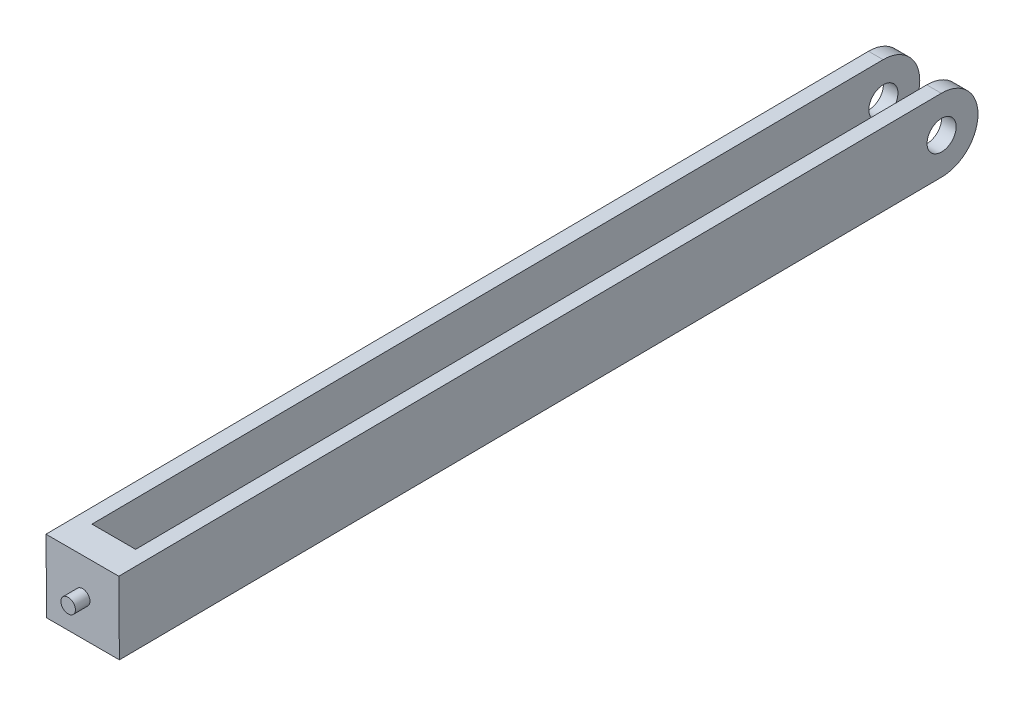
from build123d import *

# Parameters (mm, degrees)
SKETCH1_R               = 5
BOSS_EXTRUDE1_DEPTH     = 25
CUT_EXTRUDE1_DEPTH      = 35
CUT_EXTRUDE1_DEPTH_BACK = 15
SKETCH2_W               = 15
SKETCH2_H               = 290
SKETCH3_R               = 5
CUT_EXTRUDE4_DEPTH      = 40
SKETCH7_W               = 25
SKETCH7_H               = 28.664698835
CUT_EXTRUDE7_DEPTH      = 30
SKETCH9_R               = 2.5
BOSS_EXTRUDE3_DEPTH     = 5


with BuildPart() as part:
    # Sketch1 → Boss-Extrude1 (new body)
    with BuildSketch(Plane(origin=(0, 0, 0), x_dir=(0, 0, -1), z_dir=(1, 0, 0))):
        with BuildLine():
            Line((-150.552761917, 18.987019815), (149.447238083, 21.532711721))
            ThreePointArc((149.447238083, 21.532711721), (162.052854746, 9.139228412), (149.659371437, -3.466388252))
            Line((149.659371437, -3.466388252), (-150.340628563, -6.012080158))
            ThreePointArc((-150.340628563, -6.012080158), (-162.946245226, 6.381403151), (-150.552761917, 18.987019815))
        make_face()
        with Locations((149.55330476, 9.033161734)):
            Circle(SKETCH1_R, mode=Mode.SUBTRACT)
    extrude(amount=BOSS_EXTRUDE1_DEPTH)

    # Sketch2 → Cut-Extrude1 (cut, two sides: drawn at the far end of the back side and taken through both)
    with BuildSketch(Plane(origin=(0, 0, 0), x_dir=(1, 0, 0), z_dir=(0, 1, 0)).offset(-CUT_EXTRUDE1_DEPTH_BACK)):
        with Locations((12.5, 22.738394002)):
            Rectangle(SKETCH2_W, SKETCH2_H)
    extrude(amount=CUT_EXTRUDE1_DEPTH + CUT_EXTRUDE1_DEPTH_BACK, mode=Mode.SUBTRACT)

    # Sketch3 → Cut-Extrude4 (cut)
    with BuildSketch(Plane(origin=(25, 0, 0), x_dir=(0, 0, -1), z_dir=(1, 0, 0))):
        with Locations((-150.44669524, 6.487469828)):
            Circle(SKETCH3_R)
    extrude(amount=-CUT_EXTRUDE4_DEPTH, mode=Mode.SUBTRACT)

    # Sketch7 → Cut-Extrude7 (cut)
    with BuildSketch(Plane(origin=(0, -1.382144103, 162.880366562), x_dir=(1, 0, 0), z_dir=(0, -0.008485334194353043, 0.9999639989037656))):
        with Locations((12.5, 7.004905365)):
            Rectangle(SKETCH7_W, SKETCH7_H)
    extrude(amount=-CUT_EXTRUDE7_DEPTH, mode=Mode.SUBTRACT)

    # Sketch9 → Boss-Extrude3 (add)
    with BuildSketch(Plane(origin=(0, -1.127584077, 132.881446595), x_dir=(1, 0, 0), z_dir=(0, -0.008485334194353164, 0.9999639989037656))):
        with Locations(Location((12.5, 7.76382676, 0), (0, 0, 270))):
            Circle(SKETCH9_R)
    extrude(amount=BOSS_EXTRUDE3_DEPTH)


solid = part.part
